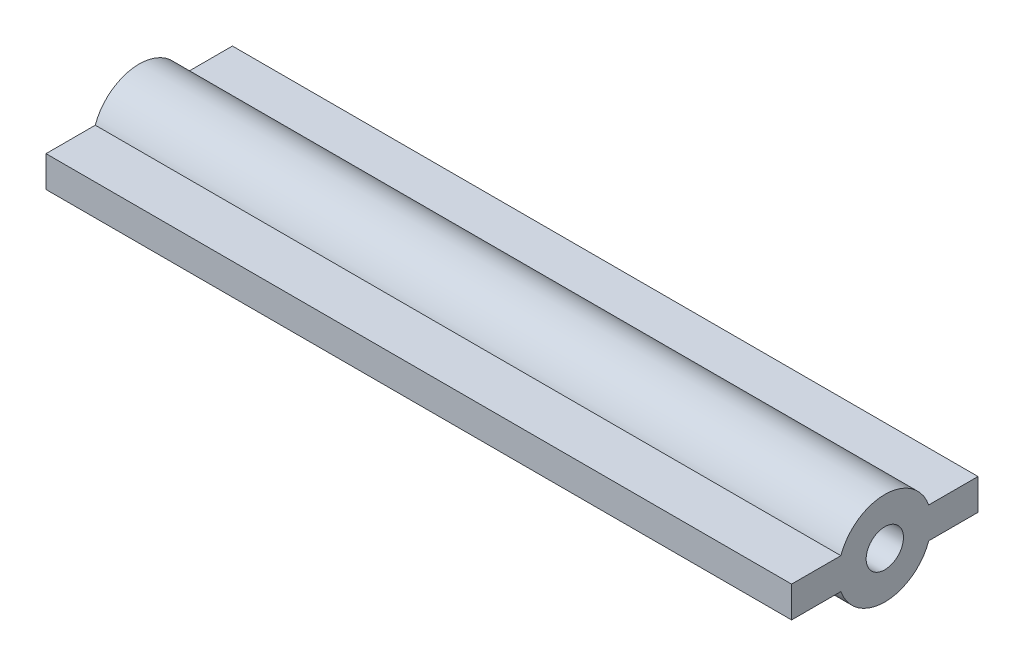
from build123d import *

# Parameters (mm, degrees)
SKETCH_1_R          = 3
EXTRUDE_1_DEPTH     = 120
CUT_EXTRUDE_1_DEPTH = 6


with BuildPart() as part:
    # Эскиз1 → Бобышка-Вытянуть1 (new body)
    with BuildSketch(Plane(origin=(0, 0, 0), x_dir=(0, 0, -1), z_dir=(1, 0, 0))):
        with BuildLine():
            Line((-15, 2.5), (-7.071067812, 2.5))
            ThreePointArc((-7.071067812, 2.5), (0, 7.5), (7.071067812, 2.5))
            Line((7.071067812, 2.5), (15, 2.5))
            Line((15, 2.5), (15, -2.5))
            Line((15, -2.5), (7.071067812, -2.5))
            ThreePointArc((7.071067812, -2.5), (0, -7.5), (-7.071067812, -2.5))
            Line((-7.071067812, -2.5), (-15, -2.5))
            Line((-15, -2.5), (-15, 2.5))
        make_face()
        Circle(SKETCH_1_R, mode=Mode.SUBTRACT)
    extrude(amount=EXTRUDE_1_DEPTH)

    # Эскиз2 → Вырез-Вытянуть1 (cut)
    with BuildSketch(Plane.ZY):
        Polygon((1.688931143, 3.671627014), (4.024187839, 0.373156232), (2.335256696, -3.298470782), (-1.688931143, -3.671627014), (-4.024187839, -0.373156232), (-2.335256696, 3.298470782), align=None)
    extrude(amount=-CUT_EXTRUDE_1_DEPTH, mode=Mode.SUBTRACT)


solid = part.part
